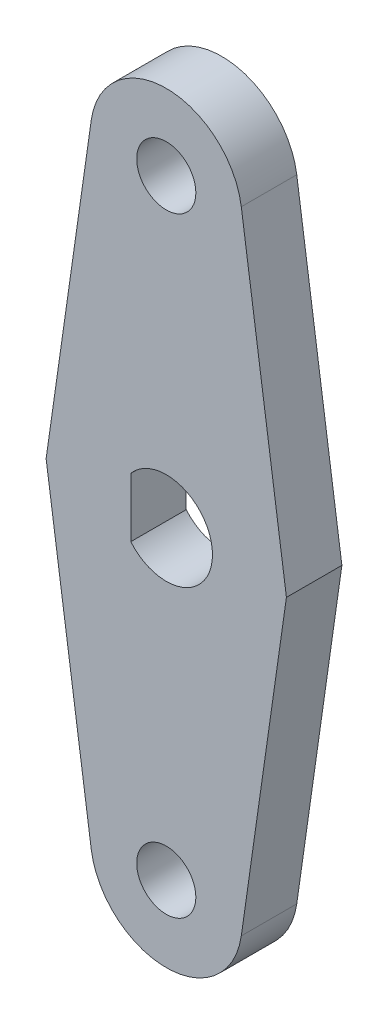
from build123d import *

# Parameters (mm, degrees)
CROQUIS1_R              = 1.6
SALIENTE_EXTRUIR1_DEPTH = 3


with BuildPart() as part:
    # Croquis1 → Saliente-Extruir1 (new body)
    with BuildSketch(Plane(origin=(0, 0, 0), x_dir=(0, 1, 0), z_dir=(0, 0, 1))):
        with BuildLine():
            Line((0, 6.5), (-17.080114399, 4.058751937))
            ThreePointArc((-17.080114399, 4.058751937), (-20.6, 0), (-17.080114399, -4.058751937))
            Line((-17.080114399, -4.058751937), (0, -6.5))
            Line((0, -6.5), (17.080114399, -4.058751937))
            ThreePointArc((17.080114399, -4.058751937), (20.6, 0), (17.080114399, 4.058751937))
            Line((17.080114399, 4.058751937), (0, 6.5))
        make_face()
        with BuildLine():
            Line((-1.601124605, 1.92), (1.601124605, 1.92))
            ThreePointArc((1.601124605, 1.92), (0, -2.5), (-1.601124605, 1.92))
        make_face(mode=Mode.SUBTRACT)
        with Locations(Location((-16.5, 0, 0), (0, 0, 270))):
            Circle(CROQUIS1_R, mode=Mode.SUBTRACT)
        with Locations(Location((16.5, 0, 0), (0, 0, 270))):
            Circle(CROQUIS1_R, mode=Mode.SUBTRACT)
    extrude(amount=SALIENTE_EXTRUIR1_DEPTH)


solid = part.part
